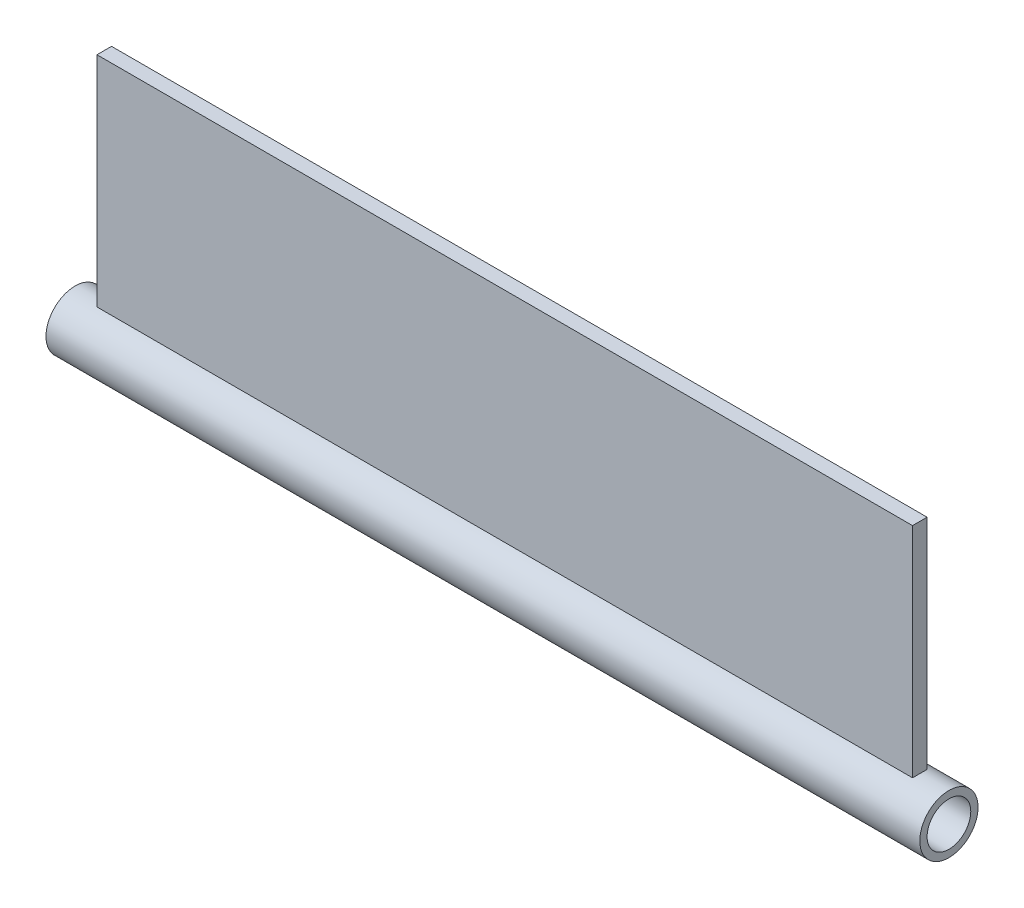
from build123d import *

# Parameters (mm, degrees)
SKETCH1_R                = 5.08
BOSS_EXTRUDE1_DEPTH      = 152.4
SKETCH2_R                = 3.81
CUT_EXTRUDE1_DEPTH       = 152.4
BOSS_EXTRUDE2_DEPTH      = 1.27
BOSS_EXTRUDE2_DEPTH_BACK = 1.27
SKETCH3_W                = 142.24
SKETCH3_H                = 38.1


with BuildPart() as part:
    # Sketch1 → Boss-Extrude1 (new body)
    with BuildSketch(Plane(origin=(0, 0, 0), x_dir=(0, 0, -1), z_dir=(1, 0, 0))):
        Circle(SKETCH1_R)
    extrude(amount=BOSS_EXTRUDE1_DEPTH)

    # Sketch2 → Cut-Extrude1 (cut)
    with BuildSketch(Plane(origin=(152.4, 0, 0), x_dir=(0, 0, -1), z_dir=(1, 0, 0))):
        Circle(SKETCH2_R)
    extrude(amount=-CUT_EXTRUDE1_DEPTH, mode=Mode.SUBTRACT)


with BuildPart() as body_2:
    # Sketch3 → Boss-Extrude2 (new, two sides: drawn at the far end of the back side and taken through both)
    with BuildSketch(Plane.XY.offset(-BOSS_EXTRUDE2_DEPTH_BACK)):
        with Locations((76.2, 24.13)):
            Rectangle(SKETCH3_W, SKETCH3_H)
    extrude(amount=BOSS_EXTRUDE2_DEPTH + BOSS_EXTRUDE2_DEPTH_BACK)


solid = Compound([part.part, body_2.part])
